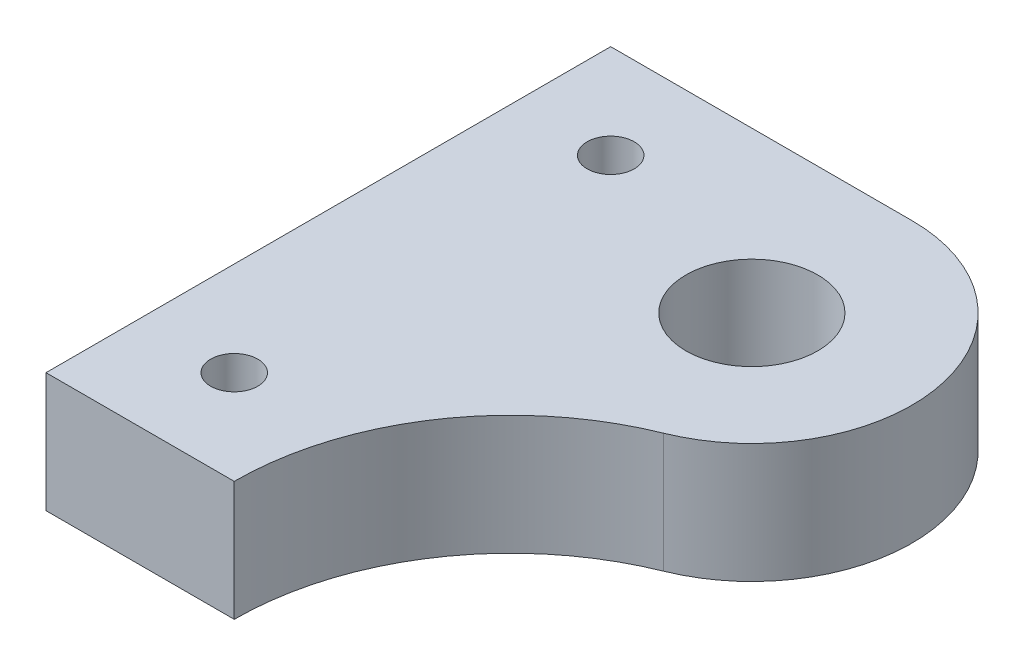
from build123d import *

# Parameters (mm, degrees)
SKETCH1_R           = 7
SKETCH1_R_2         = 2.5
BOSS_EXTRUDE1_DEPTH = 6.35


with BuildPart() as part:
    # Sketch1 → Boss-Extrude1 (new, symmetric)
    with BuildSketch(Plane(origin=(0, 0, 0), x_dir=(1, 0, 0), z_dir=(0, 1, 0))):
        with BuildLine():
            Line((20, 0), (0, 0))
            Line((0, 0), (0, 60))
            Line((0, 60), (32, 60))
            ThreePointArc((32, 60), (48.687461624, 46.244784205), (38.370260223, 27.23866171))
            ThreePointArc((38.370260223, 27.23866171), (25.021742974, 16.427196599), (20, 0))
        make_face()
        with Locations(Location((32, 43, 0), (0, 0, 270))):
            Circle(SKETCH1_R, mode=Mode.SUBTRACT)
        with Locations(Location((10, 10, 0), (0, 0, 270))):
            Circle(SKETCH1_R_2, mode=Mode.SUBTRACT)
        with Locations(Location((10, 50, 0), (0, 0, 270))):
            Circle(SKETCH1_R_2, mode=Mode.SUBTRACT)
    extrude(amount=BOSS_EXTRUDE1_DEPTH, both=True)


solid = part.part
